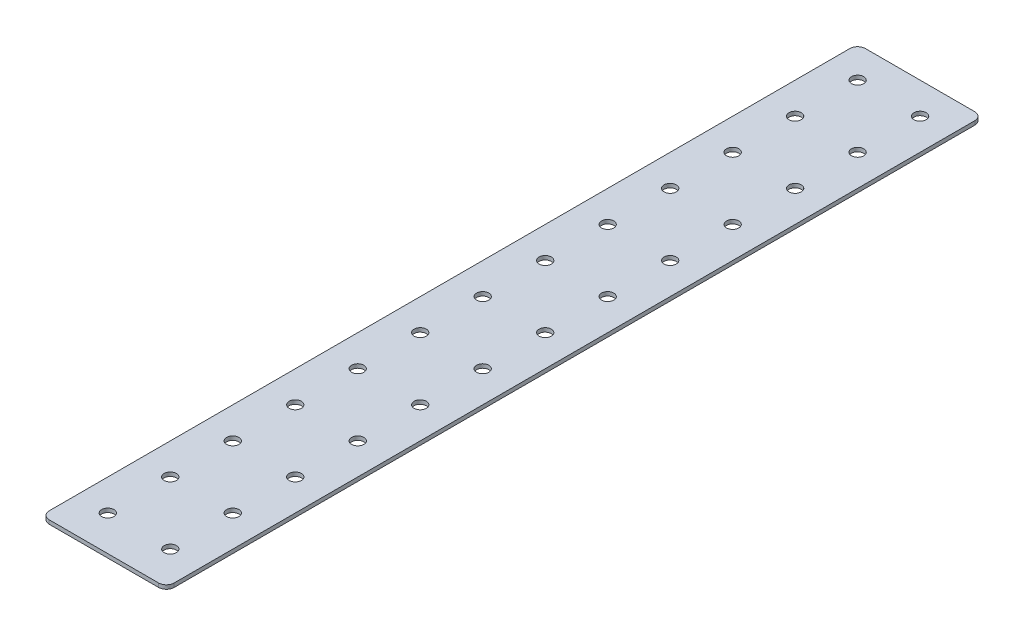
from build123d import *

# Parameters (mm, degrees)
SKETCH1_W           = 50.8
SKETCH1_H           = 331.7875
SKETCH1_R           = 2.4892
BOSS_EXTRUDE1_DEPTH = 1.5875
FILLET1_R           = 3.175


with BuildPart() as part:
    # Sketch1 → Boss-Extrude1 (new body)
    with BuildSketch(Plane(origin=(0, 0, 0), x_dir=(1, 0, 0), z_dir=(0, 1, 0))):
        with Locations((25.4, 165.89375)):
            Rectangle(SKETCH1_W, SKETCH1_H)
        with Locations(Location((12.7, 14.2875, 0), (0, 0, 270))):
            Circle(SKETCH1_R, mode=Mode.SUBTRACT)
        with Locations(Location((12.7, 39.6875, 0), (0, 0, 270))):
            Circle(SKETCH1_R, mode=Mode.SUBTRACT)
        with Locations(Location((12.7, 65.0875, 0), (0, 0, 270))):
            Circle(SKETCH1_R, mode=Mode.SUBTRACT)
        with Locations(Location((12.7, 90.4875, 0), (0, 0, 270))):
            Circle(SKETCH1_R, mode=Mode.SUBTRACT)
        with Locations(Location((12.7, 115.8875, 0), (0, 0, 270))):
            Circle(SKETCH1_R, mode=Mode.SUBTRACT)
        with Locations(Location((12.7, 141.2875, 0), (0, 0, 270))):
            Circle(SKETCH1_R, mode=Mode.SUBTRACT)
        with Locations(Location((38.1, 39.6875, 0), (0, 0, 270))):
            Circle(SKETCH1_R, mode=Mode.SUBTRACT)
        with Locations(Location((38.1, 65.0875, 0), (0, 0, 270))):
            Circle(SKETCH1_R, mode=Mode.SUBTRACT)
        with Locations(Location((38.1, 90.4875, 0), (0, 0, 270))):
            Circle(SKETCH1_R, mode=Mode.SUBTRACT)
        with Locations(Location((38.1, 115.8875, 0), (0, 0, 270))):
            Circle(SKETCH1_R, mode=Mode.SUBTRACT)
        with Locations(Location((38.1, 141.2875, 0), (0, 0, 270))):
            Circle(SKETCH1_R, mode=Mode.SUBTRACT)
        with Locations(Location((38.1, 14.2875, 0), (0, 0, 270))):
            Circle(SKETCH1_R, mode=Mode.SUBTRACT)
        with Locations(Location((12.7, 166.6875, 0), (0, 0, 270))):
            Circle(SKETCH1_R, mode=Mode.SUBTRACT)
        with Locations(Location((38.1, 166.6875, 0), (0, 0, 270))):
            Circle(SKETCH1_R, mode=Mode.SUBTRACT)
        with Locations(Location((12.7, 319.0875, 0), (0, 0, 270))):
            Circle(SKETCH1_R, mode=Mode.SUBTRACT)
        with Locations(Location((38.1, 319.0875, 0), (0, 0, 270))):
            Circle(SKETCH1_R, mode=Mode.SUBTRACT)
        with Locations(Location((12.7, 293.6875, 0), (0, 0, 270))):
            Circle(SKETCH1_R, mode=Mode.SUBTRACT)
        with Locations(Location((38.1, 293.6875, 0), (0, 0, 270))):
            Circle(SKETCH1_R, mode=Mode.SUBTRACT)
        with Locations(Location((12.7, 268.2875, 0), (0, 0, 270))):
            Circle(SKETCH1_R, mode=Mode.SUBTRACT)
        with Locations(Location((38.1, 268.2875, 0), (0, 0, 270))):
            Circle(SKETCH1_R, mode=Mode.SUBTRACT)
        with Locations(Location((12.7, 242.8875, 0), (0, 0, 270))):
            Circle(SKETCH1_R, mode=Mode.SUBTRACT)
        with Locations(Location((38.1, 242.8875, 0), (0, 0, 270))):
            Circle(SKETCH1_R, mode=Mode.SUBTRACT)
        with Locations(Location((12.7, 217.4875, 0), (0, 0, 270))):
            Circle(SKETCH1_R, mode=Mode.SUBTRACT)
        with Locations(Location((38.1, 217.4875, 0), (0, 0, 270))):
            Circle(SKETCH1_R, mode=Mode.SUBTRACT)
        with Locations(Location((12.7, 192.0875, 0), (0, 0, 270))):
            Circle(SKETCH1_R, mode=Mode.SUBTRACT)
        with Locations(Location((38.1, 192.0875, 0), (0, 0, 270))):
            Circle(SKETCH1_R, mode=Mode.SUBTRACT)
    extrude(amount=BOSS_EXTRUDE1_DEPTH)

    # Fillet1
    fillet1_edges = [part.edges().sort_by_distance(p)[0] for p in [
        (0, 0.79375, -331.7875),
        (50.8, 0.79375, -331.7875),
        (50.8, 0.79375, 0),
        (0, 0.79375, 0),
    ]]
    fillet(fillet1_edges, radius=FILLET1_R)


solid = part.part
